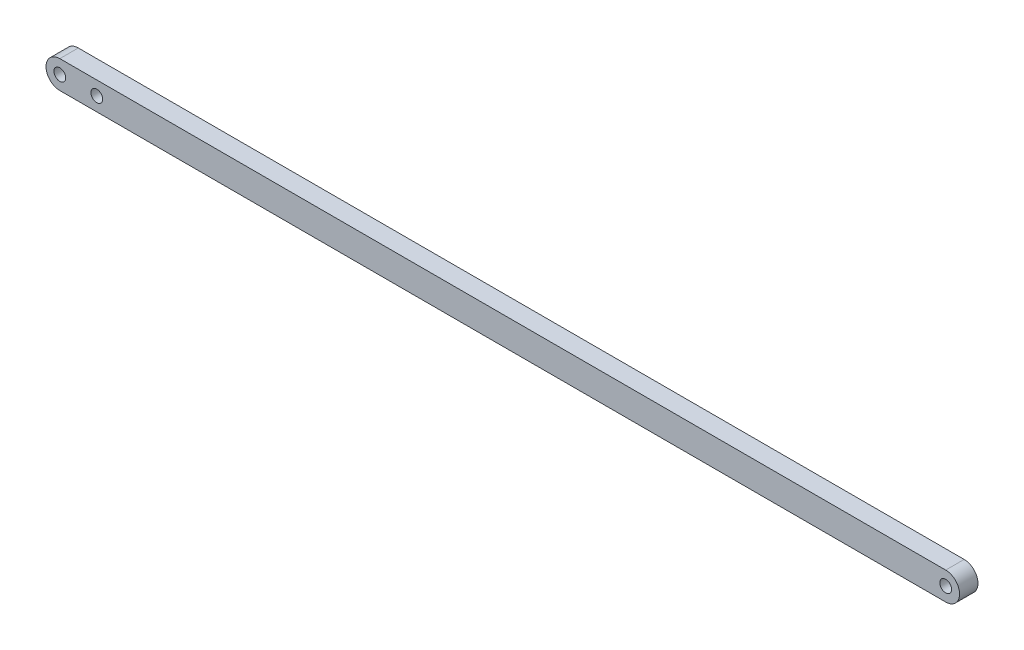
from build123d import *

# Parameters (mm, degrees)
SKETCH1_R           = 2.032
BOSS_EXTRUDE1_DEPTH = 6.35


with BuildPart() as part:
    # Sketch1 → Boss-Extrude1 (new body)
    with BuildSketch(Plane.XY):
        with BuildLine():
            Line((0, 4.7625), (304.8, 4.7625))
            ThreePointArc((304.8, 4.7625), (309.5625, 0), (304.8, -4.7625))
            Line((304.8, -4.7625), (0, -4.7625))
            ThreePointArc((0, -4.7625), (-4.7625, 0), (0, 4.7625))
        make_face()
        Circle(SKETCH1_R, mode=Mode.SUBTRACT)
        with Locations((304.8, 0)):
            Circle(SKETCH1_R, mode=Mode.SUBTRACT)
        with Locations((12.7, 0)):
            Circle(SKETCH1_R, mode=Mode.SUBTRACT)
    extrude(amount=BOSS_EXTRUDE1_DEPTH)


solid = part.part
